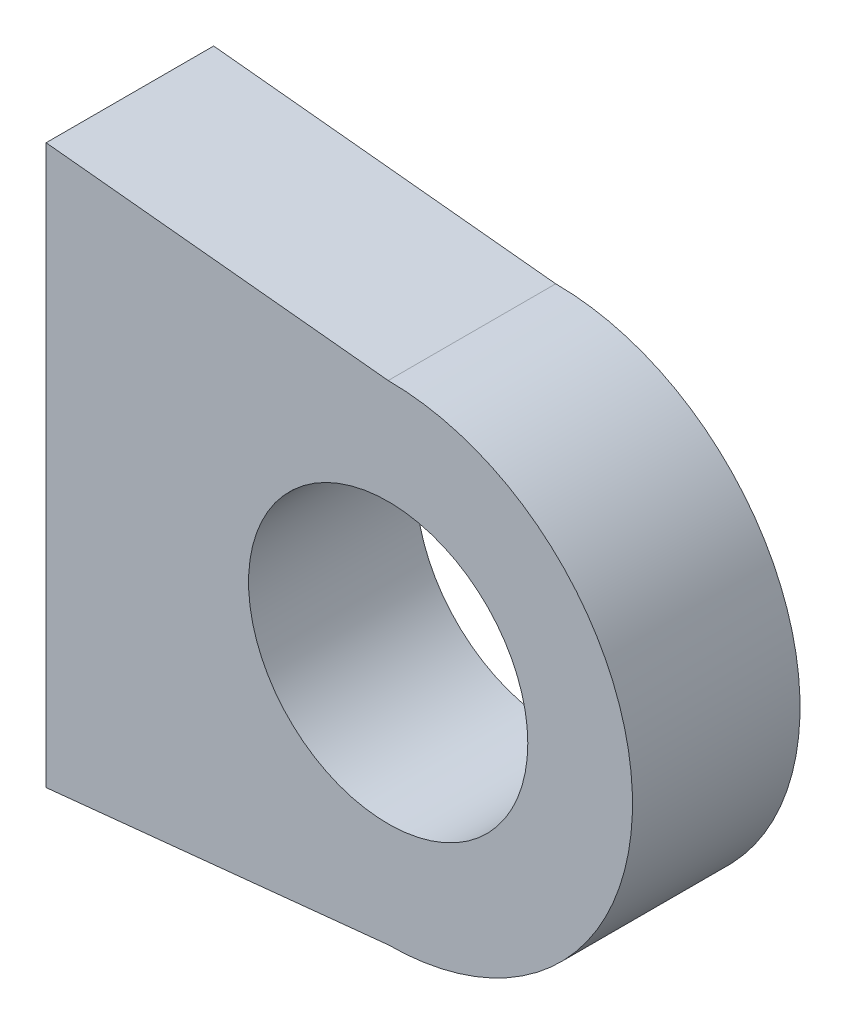
from build123d import *

# Parameters (mm, degrees)
SKETCH1_R           = 5
BOSS_EXTRUDE1_DEPTH = 6
SKETCH2_R           = 1.35
SKETCH2_R_2         = 2
CUT_EXTRUDE1_DEPTH  = 3


with BuildPart() as part:
    # Sketch1 → Boss-Extrude1 (new body)
    with BuildSketch(Plane.XY):
        with BuildLine():
            Line((0, 0), (0, 10))
            Line((0, 10), (12.25, 8.75))
            ThreePointArc((12.25, 8.75), (21, 0), (12.25, -8.75))
            Line((12.25, -8.75), (0, -10))
            Line((0, -10), (0, 0))
        make_face()
        with Locations((12.25, 0)):
            Circle(SKETCH1_R, mode=Mode.SUBTRACT)
    extrude(amount=BOSS_EXTRUDE1_DEPTH)

    # Sketch2 → Cut-Extrude1 (cut)
    with BuildSketch(Plane.ZY):
        with Locations((3, 7.1)):
            Circle(SKETCH2_R)
        with Locations((3, -7.1)):
            Circle(SKETCH2_R)
        with Locations((3, 0)):
            Circle(SKETCH2_R_2)
    extrude(amount=-CUT_EXTRUDE1_DEPTH, mode=Mode.SUBTRACT)


solid = part.part
